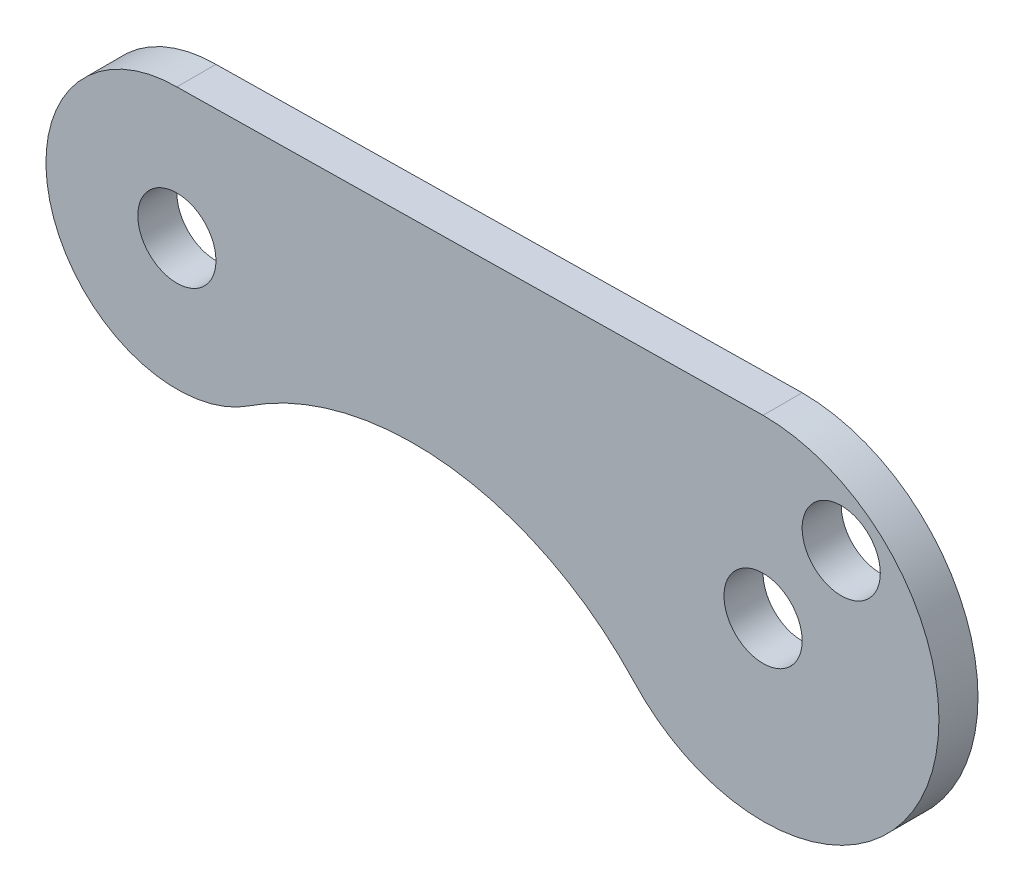
from build123d import *

# Parameters (mm, degrees)
SKETCH1_R           = 2
BOSS_EXTRUDE1_DEPTH = 2


with BuildPart() as part:
    # Sketch1 → Boss-Extrude1 (new body)
    with BuildSketch(Plane.XY):
        with BuildLine():
            Line((-1.2887257, 9.27170727), (-31.0207003, 8.828891045))
            ThreePointArc((-31.0207003, 8.828891045), (-37.4360697, 0.196784564), (-27.320647525, -3.456770014))
            ThreePointArc((-27.320647525, -3.456770014), (-17.039618289, -1.022120458), (-7.632023625, -5.830887792))
            ThreePointArc((-7.632023625, -5.830887792), (7.224276423, -3.332674299), (-1.0207003, 9.275699134))
            Line((-1.0207003, 9.275699134), (-1.2887257, 9.27170727))
        make_face()
        with Locations((-31.0207003, 2.128891045)):
            Circle(SKETCH1_R, mode=Mode.SUBTRACT)
        with Locations((-1.0207003, 0.275699134)):
            Circle(SKETCH1_R, mode=Mode.SUBTRACT)
        with Locations((2.9792997, 5.275699134)):
            Circle(SKETCH1_R, mode=Mode.SUBTRACT)
    extrude(amount=BOSS_EXTRUDE1_DEPTH)


solid = part.part
